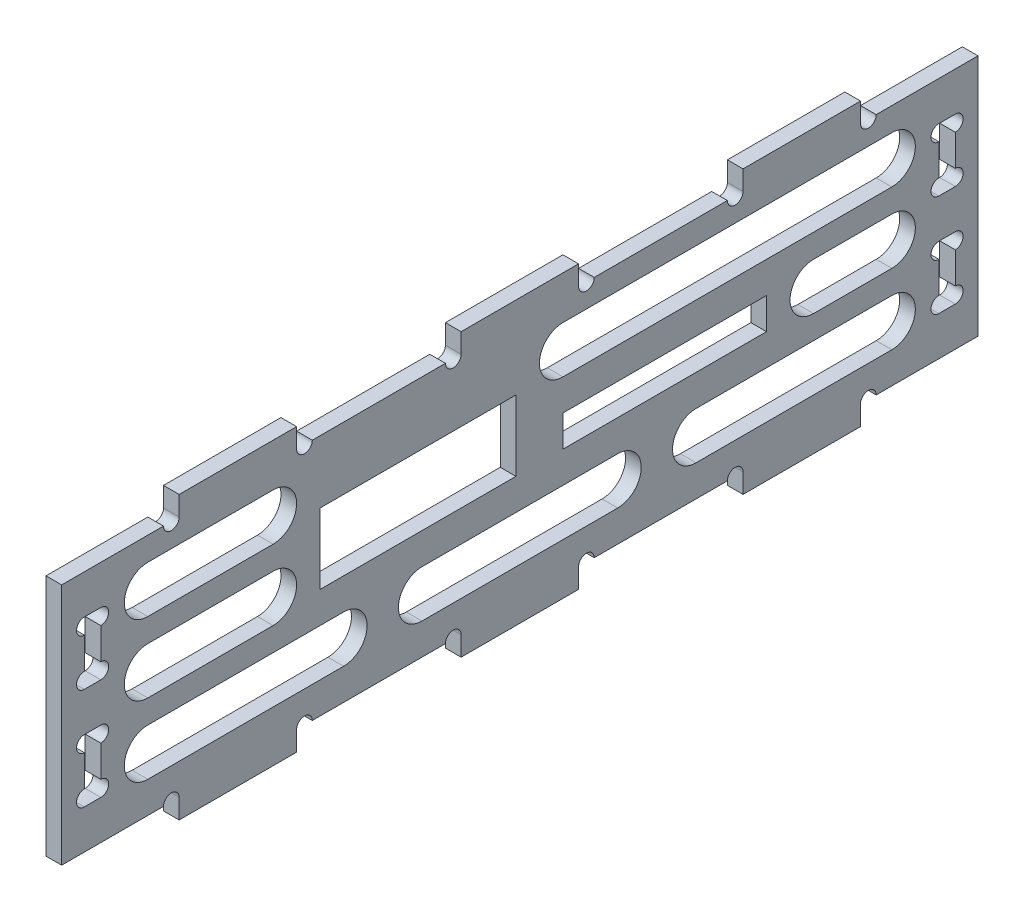
from build123d import *

# Parameters (mm, degrees)
SKETCH_1_W          = 107
SKETCH_1_H          = 31
SKETCH_1_W_2        = 26
SKETCH_1_H_2        = 4
SKETCH_1_W_3        = 25
SKETCH_1_H_3        = 9
EXTRUDE_1_DEPTH     = 2
EXTRUDE_2_DEPTH     = 2
CUT_EXTRUDE_1_DEPTH = 117.228223767
SKETCH_5_W          = 15
SKETCH_5_H          = 2.5
EXTRUDE_3_DEPTH     = 2
CUT_EXTRUDE_2_DEPTH = 117.919844338
CUT_EXTRUDE_3_DEPTH = 117.919844338


with BuildPart() as part:
    # 草图1 → 凸台-拉伸1 (new body)
    with BuildSketch(Plane(origin=(0, 0, 0), x_dir=(0, 0, -1), z_dir=(1, 0, 0))):
        with Locations((53.5, 15.5)):
            Rectangle(SKETCH_1_W, SKETCH_1_H)
        with Locations((72, 16)):
            Rectangle(SKETCH_1_W_2, SKETCH_1_H_2, mode=Mode.SUBTRACT)
        with Locations((40.5, 18.5)):
            Rectangle(SKETCH_1_W_3, SKETCH_1_H_3, mode=Mode.SUBTRACT)
    extrude(amount=EXTRUDE_1_DEPTH)

    # 草图2 → 凸台-拉伸2 (add)
    with BuildSketch(Plane(origin=(2, 0, 0), x_dir=(0, 0, -1), z_dir=(1, 0, 0))):
        Polygon((0, 31), (-5, 31), (-5, 0), (0, 0), (0, 5), (-2.1, 5), (-2.1, 13), (0, 13), (0, 18), (-2.1, 18), (-2.1, 26), (0, 26), align=None)
        Polygon((107, 0), (107, 5), (109.1, 5), (109.1, 13), (107, 13), (107, 18), (109.1, 18), (109.1, 26), (107, 26), (107, 31), (112, 31), (112, 0), align=None)
    extrude(amount=-EXTRUDE_2_DEPTH)

    # 草图3 → 切除-拉伸1 (cut, through all)
    with BuildSketch(Plane(origin=(2, 0, 0), x_dir=(0, 0, -1), z_dir=(1, 0, 0))):
        with BuildLine():
            Line((-2.1, 24), (-2.1, 26))
            ThreePointArc((-2.1, 26), (-3.1, 25), (-2.1, 24))
        make_face()
        with BuildLine():
            Line((0, 24), (0, 26))
            ThreePointArc((0, 26), (1, 25), (0, 24))
        make_face()
        with BuildLine():
            Line((0, 20), (0, 18))
            ThreePointArc((0, 18), (1, 19), (0, 20))
        make_face()
        with BuildLine():
            Line((-2.1, 20), (-2.1, 18))
            ThreePointArc((-2.1, 18), (-3.1, 19), (-2.1, 20))
        make_face()
        with BuildLine():
            Line((-2.1, 11), (-2.1, 13))
            ThreePointArc((-2.1, 13), (-3.1, 12), (-2.1, 11))
        make_face()
        with BuildLine():
            Line((0, 11), (0, 13))
            ThreePointArc((0, 13), (1, 12), (0, 11))
        make_face()
        with BuildLine():
            Line((0, 7), (0, 5))
            ThreePointArc((0, 5), (1, 6), (0, 7))
        make_face()
        with BuildLine():
            Line((-2.1, 7), (-2.1, 5))
            ThreePointArc((-2.1, 5), (-3.1, 6), (-2.1, 7))
        make_face()
        with BuildLine():
            Line((109.1, 7), (109.1, 5))
            ThreePointArc((109.1, 5), (110.1, 6), (109.1, 7))
        make_face()
        with BuildLine():
            Line((107, 7), (107, 5))
            ThreePointArc((107, 5), (106, 6), (107, 7))
        make_face()
        with BuildLine():
            Line((107, 11), (107, 13))
            ThreePointArc((107, 13), (106, 12), (107, 11))
        make_face()
        with BuildLine():
            Line((109.1, 11), (109.1, 13))
            ThreePointArc((109.1, 13), (110.1, 12), (109.1, 11))
        make_face()
        with BuildLine():
            Line((109.1, 20), (109.1, 18))
            ThreePointArc((109.1, 18), (110.1, 19), (109.1, 20))
        make_face()
        with BuildLine():
            Line((107, 20), (107, 18))
            ThreePointArc((107, 18), (106, 19), (107, 20))
        make_face()
        with BuildLine():
            Line((107, 24), (107, 26))
            ThreePointArc((107, 26), (106, 25), (107, 24))
        make_face()
        with BuildLine():
            Line((109.1, 24), (109.1, 26))
            ThreePointArc((109.1, 26), (110.1, 25), (109.1, 24))
        make_face()
    extrude(amount=-CUT_EXTRUDE_1_DEPTH, mode=Mode.SUBTRACT)

    # 草图5 → 凸台-拉伸3 (add)
    with BuildSketch(Plane(origin=(2, 0, 0), x_dir=(0, 0, -1), z_dir=(1, 0, 0))):
        with Locations((17.5, 32.25)):
            Rectangle(SKETCH_5_W, SKETCH_5_H)
        with Locations((53.5, 32.25)):
            Rectangle(SKETCH_5_W, SKETCH_5_H)
        with Locations((89.5, 32.25)):
            Rectangle(SKETCH_5_W, SKETCH_5_H)
        with Locations((89.5, -1.25)):
            Rectangle(SKETCH_5_W, SKETCH_5_H)
        with Locations((53.5, -1.25)):
            Rectangle(SKETCH_5_W, SKETCH_5_H)
        with Locations((17.5, -1.25)):
            Rectangle(SKETCH_5_W, SKETCH_5_H)
    extrude(amount=-EXTRUDE_3_DEPTH)

    # 草图6 → 切除-拉伸2 (cut, through all)
    with BuildSketch(Plane(origin=(2, 0, 0), x_dir=(0, 0, -1), z_dir=(1, 0, 0))):
        with BuildLine():
            Line((10, 31), (8, 31))
            ThreePointArc((8, 31), (9, 30), (10, 31))
        make_face()
        with BuildLine():
            Line((25, 31), (27, 31))
            ThreePointArc((27, 31), (26, 30), (25, 31))
        make_face()
        with BuildLine():
            Line((46, 31), (44, 31))
            ThreePointArc((44, 31), (45, 30), (46, 31))
        make_face()
        with BuildLine():
            Line((61, 31), (63, 31))
            ThreePointArc((63, 31), (62, 30), (61, 31))
        make_face()
        with BuildLine():
            Line((82, 31), (80, 31))
            ThreePointArc((80, 31), (81, 30), (82, 31))
        make_face()
        with BuildLine():
            Line((97, 31), (99, 31))
            ThreePointArc((99, 31), (98, 30), (97, 31))
        make_face()
        with BuildLine():
            Line((97, 0), (99, 0))
            ThreePointArc((99, 0), (98, 1), (97, 0))
        make_face()
        with BuildLine():
            Line((82, 0), (80, 0))
            ThreePointArc((80, 0), (81, 1), (82, 0))
        make_face()
        with BuildLine():
            Line((61, 0), (63, 0))
            ThreePointArc((63, 0), (62, 1), (61, 0))
        make_face()
        with BuildLine():
            Line((46, 0), (44, 0))
            ThreePointArc((44, 0), (45, 1), (46, 0))
        make_face()
        with BuildLine():
            Line((25, 0), (27, 0))
            ThreePointArc((27, 0), (26, 1), (25, 0))
        make_face()
        with BuildLine():
            Line((10, 0), (8, 0))
            ThreePointArc((8, 0), (9, 1), (10, 0))
        make_face()
    extrude(amount=-CUT_EXTRUDE_2_DEPTH, mode=Mode.SUBTRACT)

    # 草图7 → 切除-拉伸3 (cut, through all)
    with BuildSketch(Plane(origin=(2, 0, 0), x_dir=(0, 0, -1), z_dir=(1, 0, 0))):
        with BuildLine():
            Line((6, 28), (22, 28))
            ThreePointArc((22, 28), (25, 25), (22, 22))
            Line((22, 22), (6, 22))
            ThreePointArc((6, 22), (3, 25), (6, 28))
        make_face()
        with BuildLine():
            Line((6, 10), (31, 10))
            ThreePointArc((31, 10), (34, 7), (31, 4))
            Line((31, 4), (6, 4))
            ThreePointArc((6, 4), (3, 7), (6, 10))
        make_face()
        with BuildLine():
            Line((6, 19), (22, 19))
            ThreePointArc((22, 19), (25, 16), (22, 13))
            Line((22, 13), (6, 13))
            ThreePointArc((6, 13), (3, 16), (6, 19))
        make_face()
        with BuildLine():
            Line((41, 10), (66, 10))
            ThreePointArc((66, 10), (69, 7), (66, 4))
            Line((66, 4), (41, 4))
            ThreePointArc((41, 4), (38, 7), (41, 10))
        make_face()
        with BuildLine():
            Line((76, 10), (101, 10))
            ThreePointArc((101, 10), (104, 7), (101, 4))
            Line((101, 4), (76, 4))
            ThreePointArc((76, 4), (73, 7), (76, 10))
        make_face()
        with BuildLine():
            Line((59, 28), (101, 28))
            ThreePointArc((101, 28), (104, 25), (101, 22))
            Line((101, 22), (59, 22))
            ThreePointArc((59, 22), (56, 25), (59, 28))
        make_face()
        with BuildLine():
            Line((91, 19), (101, 19))
            ThreePointArc((101, 19), (104, 16), (101, 13))
            Line((101, 13), (91, 13))
            ThreePointArc((91, 13), (88, 16), (91, 19))
        make_face()
    extrude(amount=-CUT_EXTRUDE_3_DEPTH, mode=Mode.SUBTRACT)


solid = part.part
